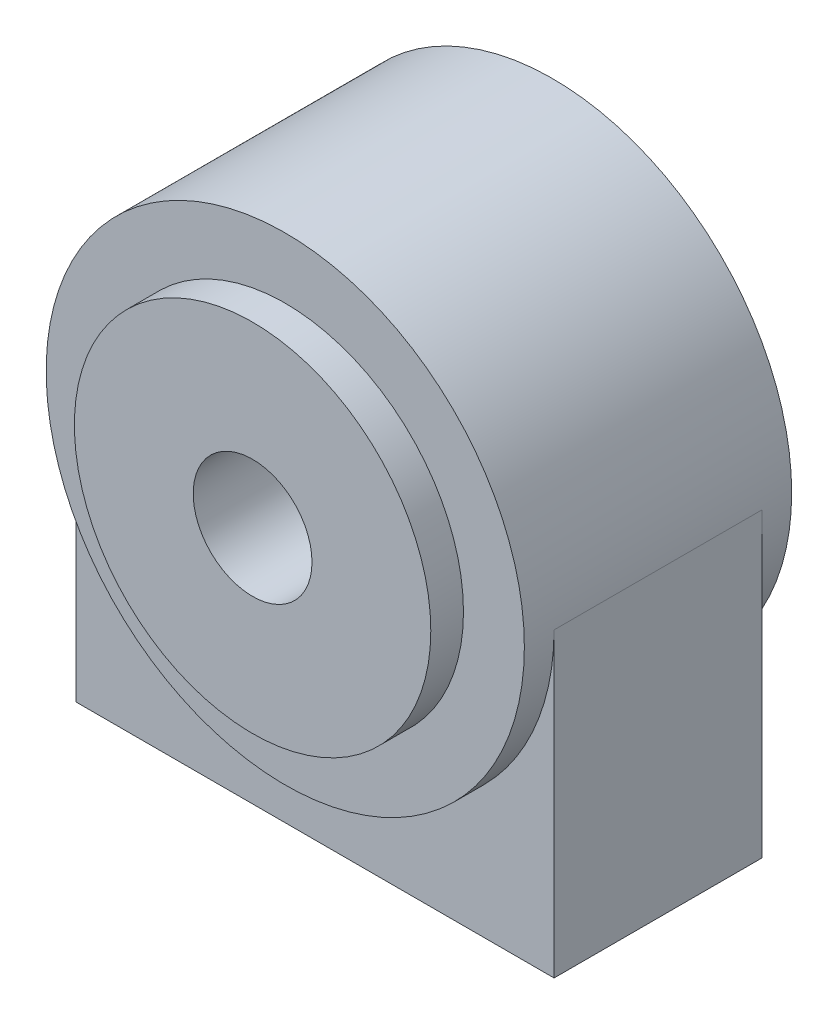
from build123d import *

# Parameters (mm, degrees)
SKETCH1_W               = 80.5
SKETCH1_H               = 50.75
BOSS_EXTRUDE1_DEPTH     = 17.5
SKETCH2_R               = 40.25
BOSS_EXTRUDE2_DEPTH     = 22.5
SKETCH3_R               = 30
BOSS_EXTRUDE3_DEPTH     = 28
CUT_EXTRUDE1_DEPTH      = 104.368575979
CUT_EXTRUDE1_DEPTH_BACK = 104.368575979
SKETCH4_R               = 10


with BuildPart() as part:
    # Sketch1 → Boss-Extrude1 (new, symmetric)
    with BuildSketch(Plane.XY):
        with Locations((0, 25.375)):
            Rectangle(SKETCH1_W, SKETCH1_H)
    extrude(amount=BOSS_EXTRUDE1_DEPTH, both=True)

    # Sketch2 → Boss-Extrude2 (add, symmetric)
    with BuildSketch(Plane.XY):
        with Locations((0, 50.75)):
            Circle(SKETCH2_R)
    extrude(amount=BOSS_EXTRUDE2_DEPTH, both=True)

    # Sketch3 → Boss-Extrude3 (add, symmetric)
    with BuildSketch(Plane.XY):
        with Locations((0, 50.75)):
            Circle(SKETCH3_R)
    extrude(amount=BOSS_EXTRUDE3_DEPTH, both=True)

    # Sketch4 → Cut-Extrude1 (cut, two sides: drawn at the far end of the back side and taken through both)
    with BuildSketch(Plane.XY.offset(-CUT_EXTRUDE1_DEPTH_BACK)):
        with Locations((0, 50.75)):
            Circle(SKETCH4_R)
    extrude(amount=CUT_EXTRUDE1_DEPTH + CUT_EXTRUDE1_DEPTH_BACK, mode=Mode.SUBTRACT)


solid = part.part
